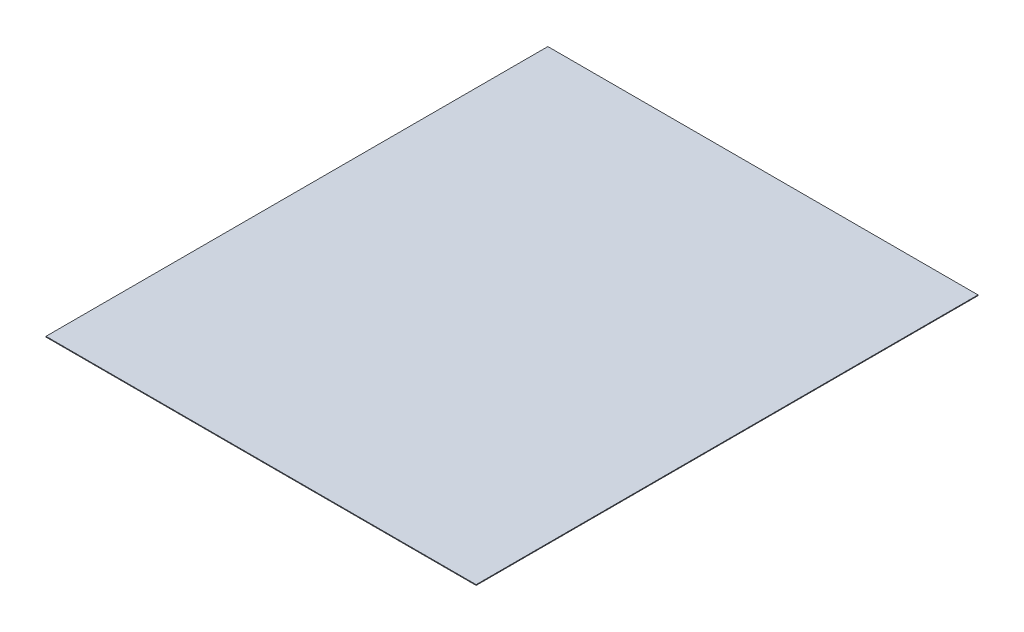
from build123d import *

# Parameters (mm, degrees)
CROQUIS1_W              = 60000
CROQUIS1_H              = 100
SALIENTE_EXTRUIR1_DEPTH = 70000


with BuildPart() as part:
    # Croquis1 → Saliente-Extruir1 (new body)
    with BuildSketch(Plane.XY):
        with Locations((30000, 50)):
            Rectangle(CROQUIS1_W, CROQUIS1_H)
    extrude(amount=-SALIENTE_EXTRUIR1_DEPTH)


solid = part.part
